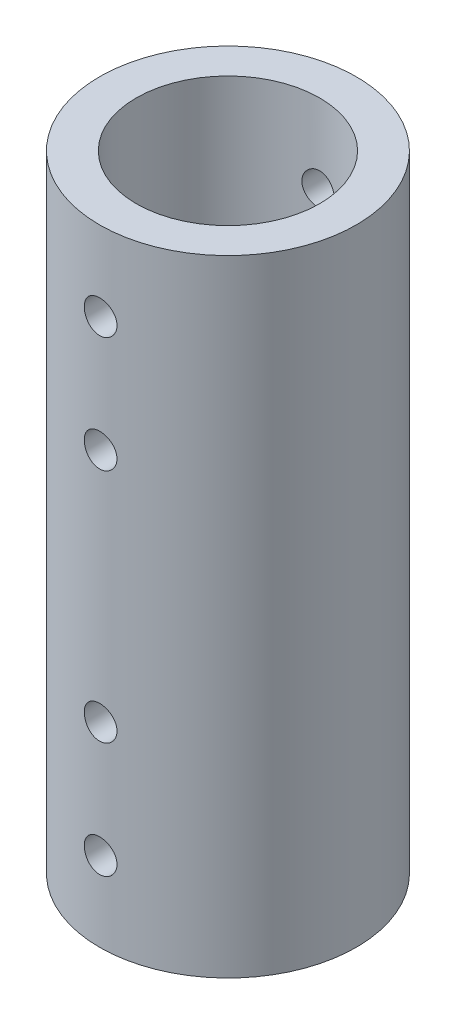
from build123d import *

# Parameters (mm, degrees)
SKETCH1_R           = 13.335
SKETCH1_R_2         = 9.525
BOSS_EXTRUDE1_DEPTH = 65
SKETCH4_R           = 1.7
CUT_EXTRUDE1_DEPTH  = 68.680458406


with BuildPart() as part:
    # Sketch1 → Boss-Extrude1 (new body)
    with BuildSketch(Plane(origin=(0, 0, 0), x_dir=(1, 0, 0), z_dir=(0, 1, 0))):
        with Locations(Location((0, 0, 0), (0, 0, 270))):
            Circle(SKETCH1_R)
        with Locations(Location((0, 0, 0), (0, 0, 270))):
            Circle(SKETCH1_R_2, mode=Mode.SUBTRACT)
    extrude(amount=BOSS_EXTRUDE1_DEPTH)

    # Sketch4 → Cut-Extrude1 (cut, symmetric)
    with BuildSketch(Plane.XY):
        with Locations((0, 56.744231704)):
            Circle(SKETCH4_R)
        with Locations((0, 44.744231704)):
            Circle(SKETCH4_R)
    cut_extrude1 = extrude(amount=CUT_EXTRUDE1_DEPTH, both=True, mode=Mode.SUBTRACT)

    # Mirror2: Cut-Extrude1 across plane
    add(cut_extrude1.mirror(Plane.ZX.offset(32.5)), mode=Mode.SUBTRACT)


solid = part.part
